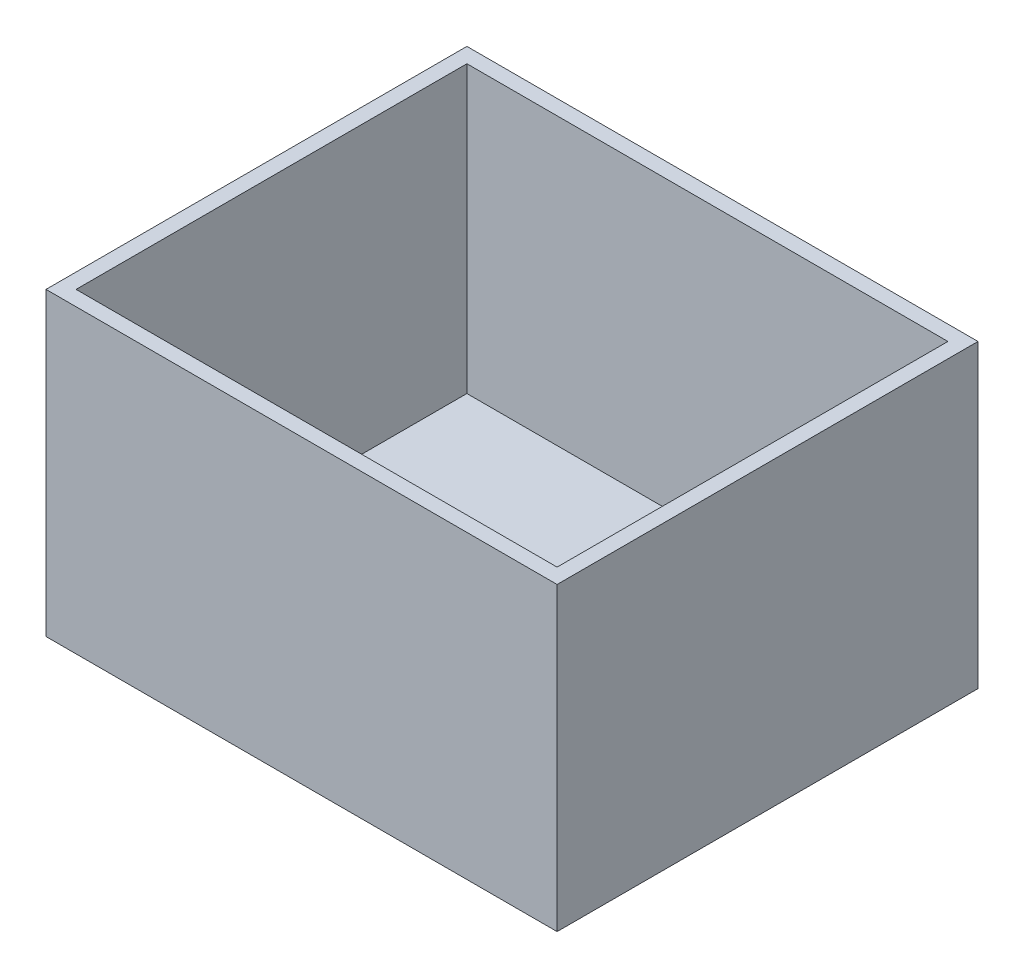
from build123d import *

# Parameters (mm, degrees)
SKETCH1_W           = 86.36
SKETCH1_H           = 71.12
BOSS_EXTRUDE3_DEPTH = 50.8
SKETCH3_W           = 81.28
SKETCH3_H           = 66.04
CUT_EXTRUDE1_DEPTH  = 48.26
SKETCH4_R           = 1.524
BOSS_EXTRUDE7_DEPTH = 6.35


with BuildPart() as part:
    # Sketch1 → Boss-Extrude3 (new body)
    with BuildSketch(Plane(origin=(0, 0, 0), x_dir=(1, 0, 0), z_dir=(0, 1, 0))):
        with Locations((43.18, 35.56)):
            Rectangle(SKETCH1_W, SKETCH1_H)
    extrude(amount=BOSS_EXTRUDE3_DEPTH)

    # Sketch3 → Cut-Extrude1 (cut)
    with BuildSketch(Plane(origin=(0, 50.8, 0), x_dir=(1, 0, 0), z_dir=(0, 1, 0))):
        with Locations((43.18, 35.56)):
            Rectangle(SKETCH3_W, SKETCH3_H)
    extrude(amount=-CUT_EXTRUDE1_DEPTH, mode=Mode.SUBTRACT)

    # Sketch4 → Boss-Extrude7 (add)
    with BuildSketch(Plane(origin=(0, 2.54, 0), x_dir=(1, 0, 0), z_dir=(0, 1, 0))):
        with Locations(Location((27.94, 36.576, 0), (0, 0, 270))):
            Circle(SKETCH4_R)
        with Locations(Location((63.5, 36.576, 0), (0, 0, 270))):
            Circle(SKETCH4_R)
        with Locations(Location((63.5, 6.35, 0), (0, 0, 270))):
            Circle(SKETCH4_R)
        with Locations(Location((27.94, 6.35, 0), (0, 0, 270))):
            Circle(SKETCH4_R)
    extrude(amount=BOSS_EXTRUDE7_DEPTH)


solid = part.part
